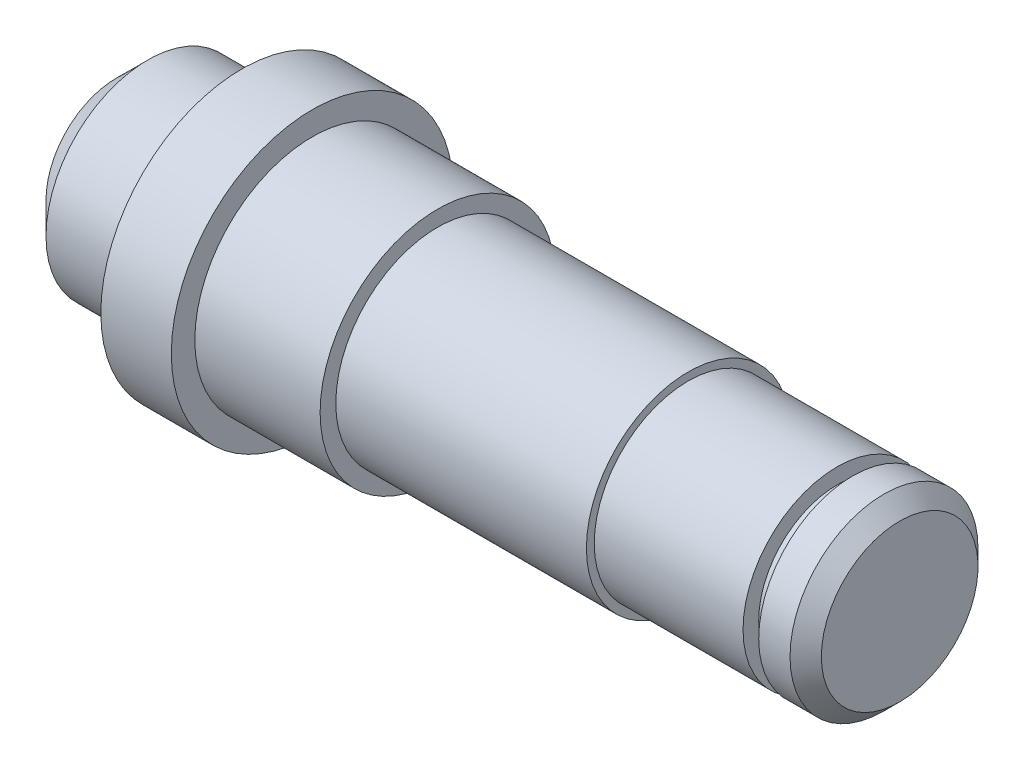
from build123d import *


with BuildPart() as part:
    # Esquisse1 → Base-Révolution (revolve)
    with BuildSketch(Plane.XY, mode=Mode.PRIVATE) as base_r_volution_sk:
        Polygon((0, 0), (0, 4.5), (2, 6.5), (8, 6.5), (8, 9), (12.5, 9), (12.5, 7.5), (20.5, 7.5), (20.5, 6.5), (36.5, 6.5), (36.5, 6), (46, 6), (46, 5), (47, 5), (47, 6), (49, 6), (50, 5), (50, 0), align=None)
    revolve(base_r_volution_sk.sketch.rotate(Axis((0, 0, 0), (1, 0, 0)), 90), axis=Axis((0, 0, 0), (1, 0, 0)))


solid = part.part
